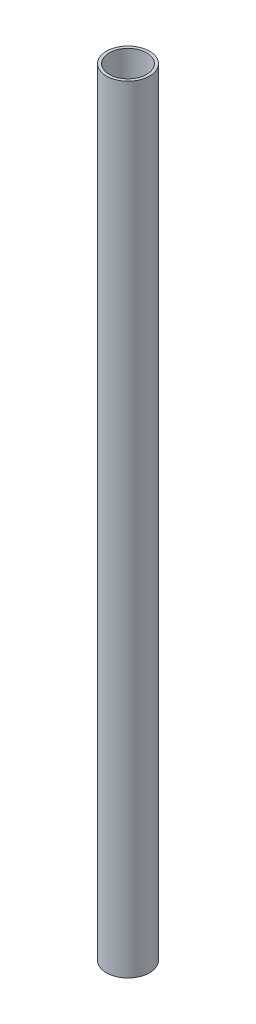
from build123d import *

# Parameters (mm, degrees)
SKETCH1_R           = 7.5
SKETCH1_R_2         = 6.5
BOSS_EXTRUDE1_DEPTH = 270


with BuildPart() as part:
    # Sketch1 → Boss-Extrude1 (new body)
    with BuildSketch(Plane(origin=(0, 0, 0), x_dir=(1, 0, 0), z_dir=(0, 1, 0))):
        with Locations(Location((0, 0, 0), (0, 0, 270))):
            Circle(SKETCH1_R)
        with Locations(Location((0, 0, 0), (0, 0, 270))):
            Circle(SKETCH1_R_2, mode=Mode.SUBTRACT)
    extrude(amount=BOSS_EXTRUDE1_DEPTH)


solid = part.part
